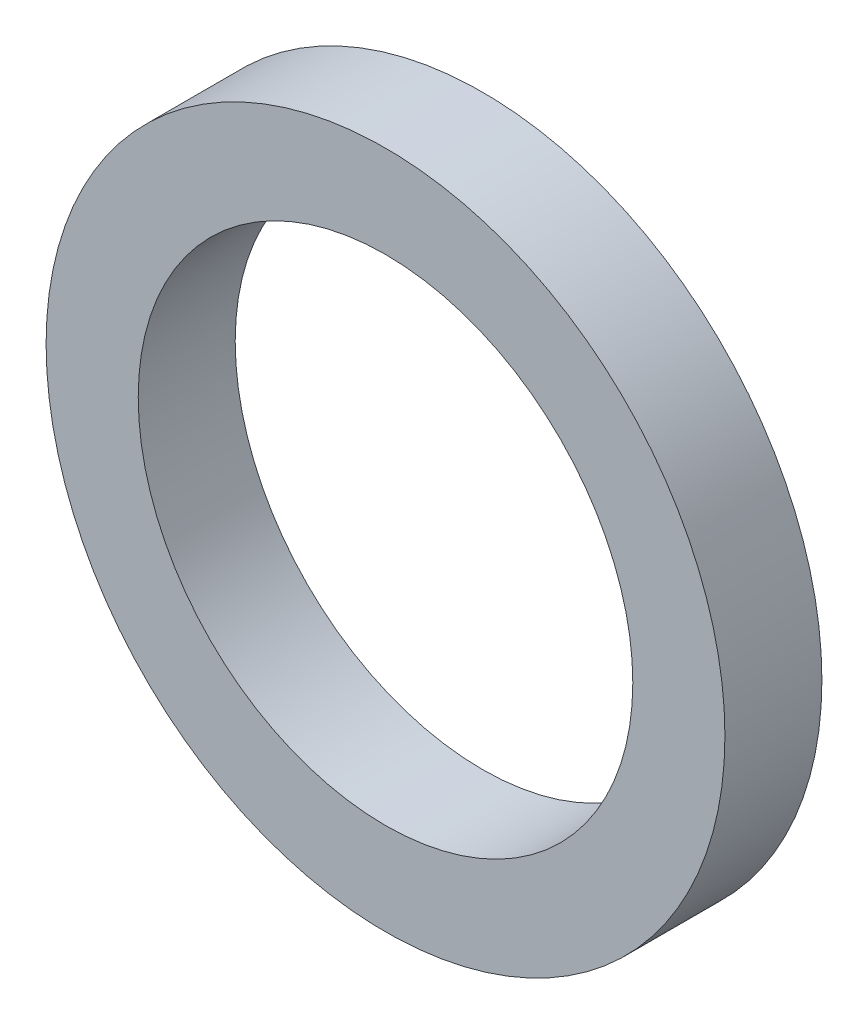
from build123d import *

# Parameters (mm, degrees)
SKETCH1_R           = 3.5
SKETCH1_R_2         = 2.55
BOSS_EXTRUDE1_DEPTH = 0.5


with BuildPart() as part:
    # Sketch1 → Boss-Extrude1 (new, symmetric)
    with BuildSketch(Plane.XY):
        Circle(SKETCH1_R)
        Circle(SKETCH1_R_2, mode=Mode.SUBTRACT)
    extrude(amount=BOSS_EXTRUDE1_DEPTH, both=True)


solid = part.part
